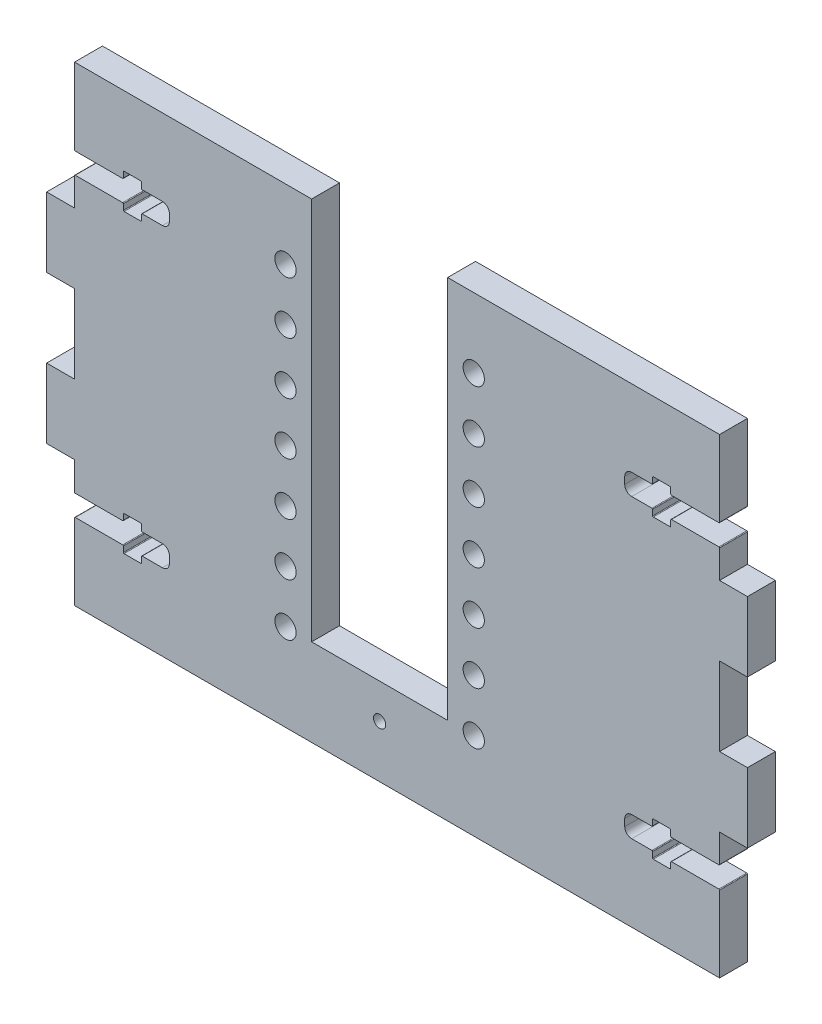
from build123d import *

# Parameters (mm, degrees)
MODEL_R             = 3.05
MODEL_R_2           = 1.75
BOSS_EXTRUDE2_DEPTH = 8


with BuildPart() as part:
    # Model → Boss-Extrude2 (new body)
    with BuildSketch(Plane.XY):
        with BuildLine():
            Line((-92.5, 21.8), (-92.5, 2))
            Line((-92.5, 2), (-92.5, 0))
            Line((-92.5, 0), (-90.5, 0))
            Line((-90.5, 0), (90.5, 0))
            Line((90.5, 0), (92.5, 0))
            Line((92.5, 0), (92.5, 2))
            Line((92.5, 2), (92.5, 21.8))
            ThreePointArc((92.5, 21.8), (92.441421356, 21.941421356), (92.3, 22))
            Line((92.3, 22), (78.7, 22))
            ThreePointArc((78.7, 22), (78.558578644, 21.941421356), (78.5, 21.8))
            Line((78.5, 21.8), (78.5, 20.2))
            ThreePointArc((78.5, 20.2), (78.441421356, 20.058578644), (78.3, 20))
            Line((78.3, 20), (73.5, 20))
            ThreePointArc((73.5, 20), (73.358578644, 20.058578644), (73.3, 20.2))
            Line((73.3, 20.2), (73.3, 21.8))
            ThreePointArc((73.3, 21.8), (73.241421356, 21.941421356), (73.1, 22))
            Line((73.1, 22), (67.3, 22))
            ThreePointArc((67.3, 22), (65.885786438, 22.585786438), (65.3, 24))
            Line((65.3, 24), (65.3, 26))
            ThreePointArc((65.3, 26), (65.885786438, 27.414213562), (67.3, 28))
            Line((67.3, 28), (73.1, 28))
            ThreePointArc((73.1, 28), (73.241421356, 28.058578644), (73.3, 28.2))
            Line((73.3, 28.2), (73.3, 29.8))
            ThreePointArc((73.3, 29.8), (73.358578644, 29.941421356), (73.5, 30))
            Line((73.5, 30), (78.3, 30))
            ThreePointArc((78.3, 30), (78.441421356, 29.941421356), (78.5, 29.8))
            Line((78.5, 29.8), (78.5, 28.2))
            ThreePointArc((78.5, 28.2), (78.558578644, 28.058578644), (78.7, 28))
            Line((78.7, 28), (92.3, 28))
            ThreePointArc((92.3, 28), (92.441421356, 28.058578644), (92.5, 28.2))
            Line((92.5, 28.2), (92.5, 36.25))
            Line((92.5, 36.25), (100.5, 36.25))
            Line((100.5, 36.25), (100.5, 56.25))
            Line((100.5, 56.25), (92.5, 56.25))
            Line((92.5, 56.25), (92.5, 78.75))
            Line((92.5, 78.75), (100.5, 78.75))
            Line((100.5, 78.75), (100.5, 98.75))
            Line((100.5, 98.75), (92.5, 98.75))
            Line((92.5, 98.75), (92.5, 106.8))
            ThreePointArc((92.5, 106.8), (92.441421356, 106.941421356), (92.3, 107))
            Line((92.3, 107), (78.7, 107))
            ThreePointArc((78.7, 107), (78.558578644, 106.941421356), (78.5, 106.8))
            Line((78.5, 106.8), (78.5, 105.2))
            ThreePointArc((78.5, 105.2), (78.441421356, 105.058578644), (78.3, 105))
            Line((78.3, 105), (73.5, 105))
            ThreePointArc((73.5, 105), (73.358578644, 105.058578644), (73.3, 105.2))
            Line((73.3, 105.2), (73.3, 106.8))
            ThreePointArc((73.3, 106.8), (73.241421356, 106.941421356), (73.1, 107))
            Line((73.1, 107), (67.3, 107))
            ThreePointArc((67.3, 107), (65.885786438, 107.585786438), (65.3, 109))
            Line((65.3, 109), (65.3, 111))
            ThreePointArc((65.3, 111), (65.885786438, 112.414213562), (67.3, 113))
            Line((67.3, 113), (73.1, 113))
            ThreePointArc((73.1, 113), (73.241421356, 113.058578644), (73.3, 113.2))
            Line((73.3, 113.2), (73.3, 114.8))
            ThreePointArc((73.3, 114.8), (73.358578644, 114.941421356), (73.5, 115))
            Line((73.5, 115), (78.3, 115))
            ThreePointArc((78.3, 115), (78.441421356, 114.941421356), (78.5, 114.8))
            Line((78.5, 114.8), (78.5, 113.2))
            ThreePointArc((78.5, 113.2), (78.558578644, 113.058578644), (78.7, 113))
            Line((78.7, 113), (92.3, 113))
            ThreePointArc((92.3, 113), (92.441421356, 113.058578644), (92.5, 113.2))
            Line((92.5, 113.2), (92.5, 133))
            Line((92.5, 133), (92.5, 135))
            Line((92.5, 135), (90.5, 135))
            Line((90.5, 135), (14.5, 135))
            Line((14.5, 135), (14.5, 25))
            Line((14.5, 25), (-24.5, 25))
            Line((-24.5, 25), (-24.5, 135))
            Line((-24.5, 135), (-90.5, 135))
            Line((-90.5, 135), (-92.5, 135))
            Line((-92.5, 135), (-92.5, 133))
            Line((-92.5, 133), (-92.5, 113.2))
            ThreePointArc((-92.5, 113.2), (-92.441421356, 113.058578644), (-92.3, 113))
            Line((-92.3, 113), (-78.7, 113))
            ThreePointArc((-78.7, 113), (-78.558578644, 113.058578644), (-78.5, 113.2))
            Line((-78.5, 113.2), (-78.5, 114.8))
            ThreePointArc((-78.5, 114.8), (-78.441421356, 114.941421356), (-78.3, 115))
            Line((-78.3, 115), (-73.5, 115))
            ThreePointArc((-73.5, 115), (-73.358578644, 114.941421356), (-73.3, 114.8))
            Line((-73.3, 114.8), (-73.3, 113.2))
            ThreePointArc((-73.3, 113.2), (-73.241421356, 113.058578644), (-73.1, 113))
            Line((-73.1, 113), (-67.3, 113))
            ThreePointArc((-67.3, 113), (-65.885786438, 112.414213562), (-65.3, 111))
            Line((-65.3, 111), (-65.3, 109))
            ThreePointArc((-65.3, 109), (-65.885786438, 107.585786438), (-67.3, 107))
            Line((-67.3, 107), (-73.1, 107))
            ThreePointArc((-73.1, 107), (-73.241421356, 106.941421356), (-73.3, 106.8))
            Line((-73.3, 106.8), (-73.3, 105.2))
            ThreePointArc((-73.3, 105.2), (-73.358578644, 105.058578644), (-73.5, 105))
            Line((-73.5, 105), (-78.3, 105))
            ThreePointArc((-78.3, 105), (-78.441421356, 105.058578644), (-78.5, 105.2))
            Line((-78.5, 105.2), (-78.5, 106.8))
            ThreePointArc((-78.5, 106.8), (-78.558578644, 106.941421356), (-78.7, 107))
            Line((-78.7, 107), (-92.3, 107))
            ThreePointArc((-92.3, 107), (-92.441421356, 106.941421356), (-92.5, 106.8))
            Line((-92.5, 106.8), (-92.5, 98.75))
            Line((-92.5, 98.75), (-100.5, 98.75))
            Line((-100.5, 98.75), (-100.5, 78.75))
            Line((-100.5, 78.75), (-92.5, 78.75))
            Line((-92.5, 78.75), (-92.5, 56.25))
            Line((-92.5, 56.25), (-100.5, 56.25))
            Line((-100.5, 56.25), (-100.5, 36.25))
            Line((-100.5, 36.25), (-92.5, 36.25))
            Line((-92.5, 36.25), (-92.5, 28.2))
            ThreePointArc((-92.5, 28.2), (-92.441421356, 28.058578644), (-92.3, 28))
            Line((-92.3, 28), (-78.7, 28))
            ThreePointArc((-78.7, 28), (-78.558578644, 28.058578644), (-78.5, 28.2))
            Line((-78.5, 28.2), (-78.5, 29.8))
            ThreePointArc((-78.5, 29.8), (-78.441421356, 29.941421356), (-78.3, 30))
            Line((-78.3, 30), (-73.5, 30))
            ThreePointArc((-73.5, 30), (-73.358578644, 29.941421356), (-73.3, 29.8))
            Line((-73.3, 29.8), (-73.3, 28.2))
            ThreePointArc((-73.3, 28.2), (-73.241421356, 28.058578644), (-73.1, 28))
            Line((-73.1, 28), (-67.3, 28))
            ThreePointArc((-67.3, 28), (-65.885786438, 27.414213562), (-65.3, 26))
            Line((-65.3, 26), (-65.3, 24))
            ThreePointArc((-65.3, 24), (-65.885786438, 22.585786438), (-67.3, 22))
            Line((-67.3, 22), (-73.1, 22))
            ThreePointArc((-73.1, 22), (-73.241421356, 21.941421356), (-73.3, 21.8))
            Line((-73.3, 21.8), (-73.3, 20.2))
            ThreePointArc((-73.3, 20.2), (-73.358578644, 20.058578644), (-73.5, 20))
            Line((-73.5, 20), (-78.3, 20))
            ThreePointArc((-78.3, 20), (-78.441421356, 20.058578644), (-78.5, 20.2))
            Line((-78.5, 20.2), (-78.5, 21.8))
            ThreePointArc((-78.5, 21.8), (-78.558578644, 21.941421356), (-78.7, 22))
            Line((-78.7, 22), (-92.3, 22))
            ThreePointArc((-92.3, 22), (-92.441421356, 21.941421356), (-92.5, 21.8))
        make_face()
        with Locations(Location((-32, 55, 0), (0, 0, 180))):
            Circle(MODEL_R, mode=Mode.SUBTRACT)
        with Locations((-32, 70)):
            Circle(MODEL_R, mode=Mode.SUBTRACT)
        with Locations(Location((22, 100, 0), (0, 0, 180))):
            Circle(MODEL_R, mode=Mode.SUBTRACT)
        with Locations((22, 85)):
            Circle(MODEL_R, mode=Mode.SUBTRACT)
        with Locations((22, 25)):
            Circle(MODEL_R, mode=Mode.SUBTRACT)
        with Locations(Location((22, 40, 0), (0, 0, 180))):
            Circle(MODEL_R, mode=Mode.SUBTRACT)
        with Locations((-32, 40)):
            Circle(MODEL_R, mode=Mode.SUBTRACT)
        with Locations(Location((-32, 25, 0), (0, 0, 180))):
            Circle(MODEL_R, mode=Mode.SUBTRACT)
        with Locations(Location((22, 70, 0), (0, 0, 180))):
            Circle(MODEL_R, mode=Mode.SUBTRACT)
        with Locations((22, 55)):
            Circle(MODEL_R, mode=Mode.SUBTRACT)
        with Locations((22, 115)):
            Circle(MODEL_R, mode=Mode.SUBTRACT)
        with Locations(Location((-32, 115, 0), (0, 0, 180))):
            Circle(MODEL_R, mode=Mode.SUBTRACT)
        with Locations(Location((-32, 85, 0), (0, 0, 180))):
            Circle(MODEL_R, mode=Mode.SUBTRACT)
        with Locations((-32, 100)):
            Circle(MODEL_R, mode=Mode.SUBTRACT)
        with Locations((-5, 15)):
            Circle(MODEL_R_2, mode=Mode.SUBTRACT)
    extrude(amount=BOSS_EXTRUDE2_DEPTH)


solid = part.part
